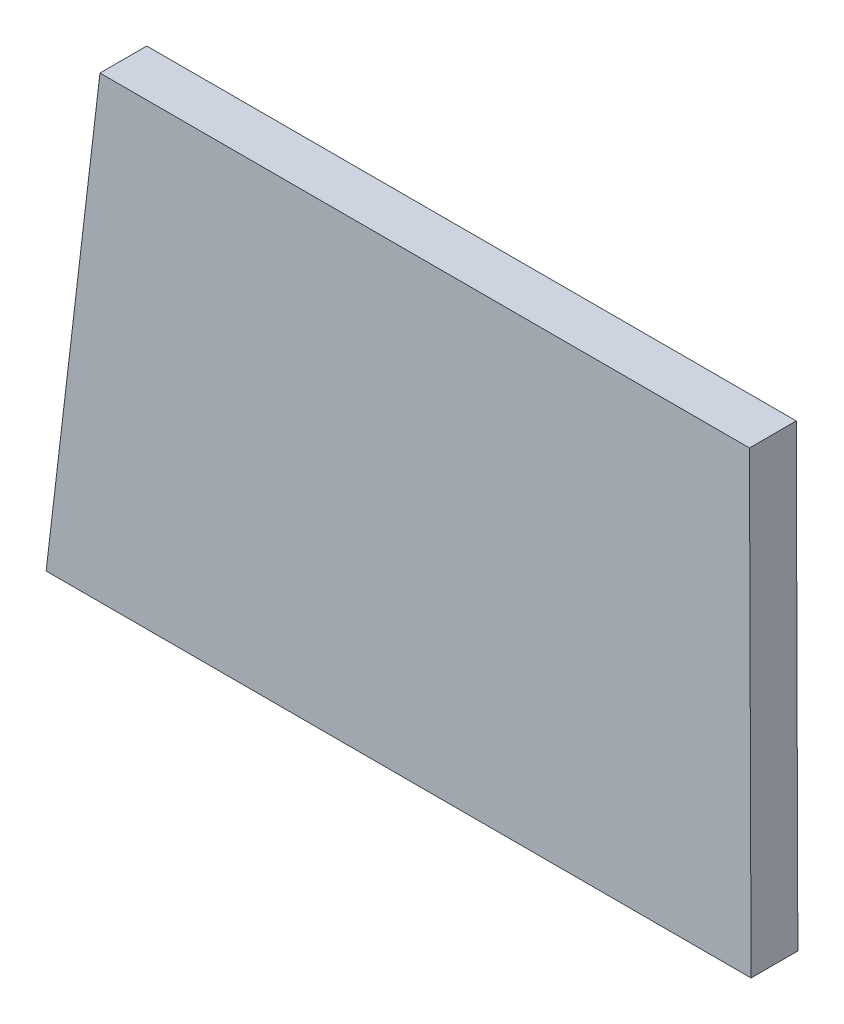
from build123d import *

# Parameters (mm, degrees)
AUFSATZ_LINEAR_AUSTRAGEN1_DEPTH = 2


with BuildPart() as part:
    # Skizze1 → Aufsatz-Linear austragen1 (new body)
    with BuildSketch(Plane.XY):
        Polygon((0, 0), (2.300163582, 19.580359356), (30.056642573, 19.582880694), (30.125, 0), align=None)
    extrude(amount=AUFSATZ_LINEAR_AUSTRAGEN1_DEPTH)


solid = part.part
